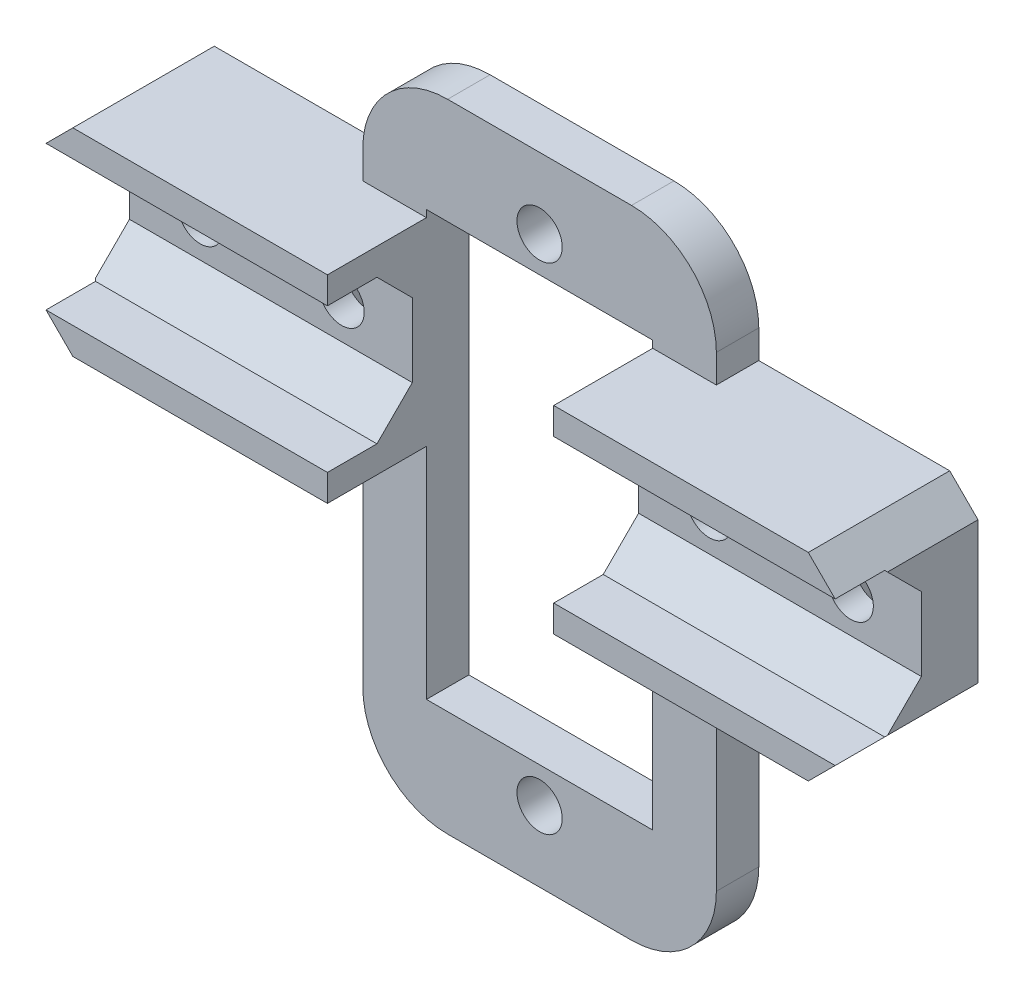
from build123d import *

# Parameters (mm, degrees)
ESQUISSE1_R             = 1.6
ESQUISSE1_W             = 16
ESQUISSE1_H             = 30
BOSS_EXTRU_1_DEPTH      = 3
ESQUISSE2_W             = 20
ESQUISSE2_H             = 14
BOSS_EXTRU_2_DEPTH      = 7
ESQUISSE3_W             = 9.671871363
ESQUISSE3_H             = 10.2
ENL_V_MAT_EXTRU_1_DEPTH = 62.173932357
CHANFREIN1_SIZE         = 2
CHANFREIN2_SIZE         = 2.5
ESQUISSE4_R             = 1.6
ENL_V_MAT_EXTRU_2_DEPTH = 7
CONG_1_R                = 6
CHANFREIN3_SIZE         = 2.1


with BuildPart() as part:
    # Esquisse1 → Boss.-Extru.1 (new body)
    with BuildSketch(Plane.XY):
        Polygon((-12.5, 14.5), (-12.5, 22.5), (12.5, 22.5), (12.5, 14.5), (28, 14.5), (28, 0.5), (12.5, 0.5), (12.5, -22.5), (-12.5, -22.5), (-12.5, 0.5), (-28, 0.5), (-28, 14.5), align=None)
        with Locations((0, 17.5)):
            Circle(ESQUISSE1_R, mode=Mode.SUBTRACT)
        with Locations((0, -17.5)):
            Circle(ESQUISSE1_R, mode=Mode.SUBTRACT)
        Rectangle(ESQUISSE1_W, ESQUISSE1_H, mode=Mode.SUBTRACT)
    extrude(amount=BOSS_EXTRU_1_DEPTH)

    # Esquisse2 → Boss.-Extru.2 (add)
    with BuildSketch(Plane.XY.offset(3)):
        with Locations((-18, 7.5)):
            Rectangle(ESQUISSE2_W, ESQUISSE2_H)
        with Locations((18, 7.5)):
            Rectangle(ESQUISSE2_W, ESQUISSE2_H)
    extrude(amount=BOSS_EXTRU_2_DEPTH)

    # Esquisse3 → Enlèv. mat.-Extru.1 (cut, through all)
    with BuildSketch(Plane.ZY.offset(28)):
        with Locations((8.835935682, 7.5)):
            Rectangle(ESQUISSE3_W, ESQUISSE3_H)
    extrude(amount=-ENL_V_MAT_EXTRU_1_DEPTH, mode=Mode.SUBTRACT)

    # Chanfrein1
    chanfrein1_edges = [part.edges().sort_by_distance(p)[0] for p in [
        (28, 0.5, 5),
        (28, 14.5, 5),
        (-28, 0.5, 5),
        (-28, 14.5, 5),
    ]]
    chamfer(chanfrein1_edges, length=CHANFREIN1_SIZE)

    # Chanfrein2
    chanfrein2_edges = [part.edges().sort_by_distance(p)[0] for p in [
        (-17.95, 12.6, 4),
        (-17.95, 2.4, 4),
        (17.95, 12.6, 4),
        (17.95, 2.4, 4),
    ]]
    chamfer(chanfrein2_edges, length=CHANFREIN2_SIZE)

    # Esquisse4 → Enlèv. mat.-Extru.2 (cut)
    with BuildSketch(Plane(origin=(0, 0, 0), x_dir=(-1, 0, 0), z_dir=(0, 0, -1))):
        with Locations((23, 7.5)):
            Circle(ESQUISSE4_R)
        with Locations((13, 7.5)):
            Circle(ESQUISSE4_R)
        with Locations((-13, 7.5)):
            Circle(ESQUISSE4_R)
        with Locations((-23, 7.5)):
            Circle(ESQUISSE4_R)
    extrude(amount=-ENL_V_MAT_EXTRU_2_DEPTH, mode=Mode.SUBTRACT)

    # Congé1
    cong_1_edges = [part.edges().sort_by_distance(p)[0] for p in [
        (12.5, -22.5, 1.5),
        (-12.5, -22.5, 1.5),
        (-12.5, 22.5, 1.5),
        (12.5, 22.5, 1.5),
    ]]
    fillet(cong_1_edges, radius=CONG_1_R)

    # Chanfrein3
    chanfrein3_edges = [part.edges().sort_by_distance(p)[0] for p in [
        (-21.4, 7.5, 0),
        (-11.4, 7.5, 0),
        (14.6, 7.5, 0),
        (24.6, 7.5, 0),
    ]]
    chamfer(chanfrein3_edges, length=CHANFREIN3_SIZE)


solid = part.part
